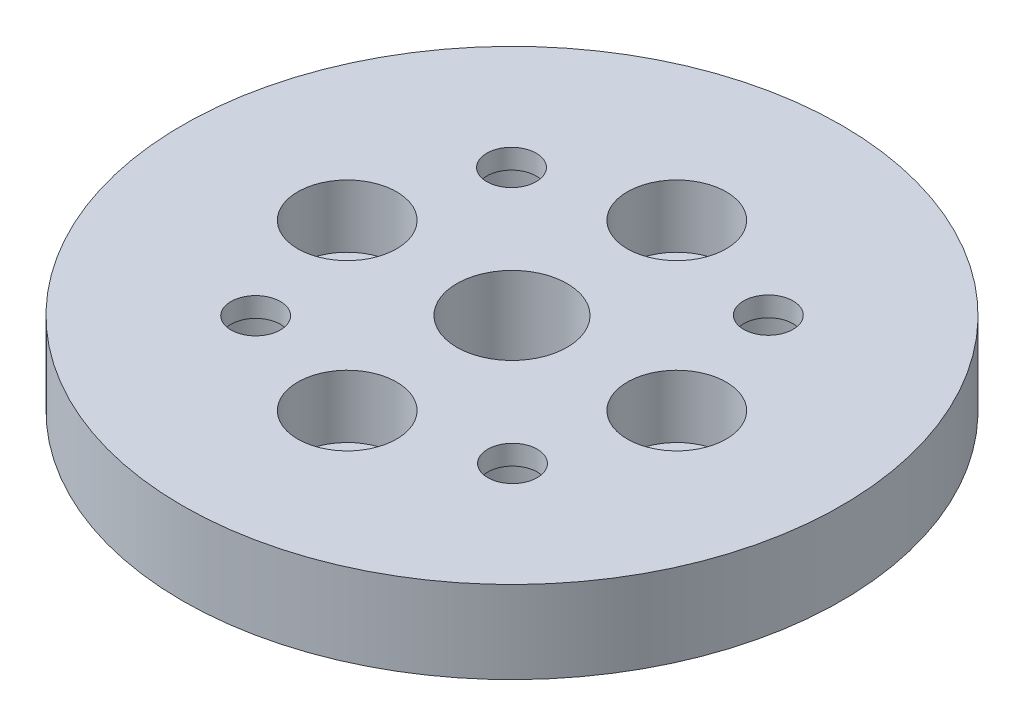
from build123d import *

# Parameters (mm, degrees)
SKETCH2_R           = 20
BOSS_EXTRUDE1_DEPTH = 5
SKETCH3_R           = 3.35
CUT_EXTRUDE1_DEPTH  = 6
SKETCH4_R           = 1.5
CUT_EXTRUDE3_DEPTH  = 6
SKETCH6_R           = 3
CUT_EXTRUDE4_DEPTH  = 3.8
SKETCH7_R           = 1.5
CUT_EXTRUDE5_DEPTH  = 29.722813233
SKETCH8_R           = 3
CUT_EXTRUDE6_DEPTH  = 3.8


with BuildPart() as part:
    # Sketch2 → Boss-Extrude1 (new body)
    with BuildSketch(Plane(origin=(0, 0, 0), x_dir=(1, 0, 0), z_dir=(0, 1, 0))):
        with Locations(Location((0, 0, 0), (0, 0, 270))):
            Circle(SKETCH2_R)
    extrude(amount=BOSS_EXTRUDE1_DEPTH)

    # Sketch3 → Cut-Extrude1 (cut)
    with BuildSketch(Plane(origin=(0, 5, 0), x_dir=(1, 0, 0), z_dir=(0, 1, 0))):
        with Locations(Location((0, 0, 0), (0, 0, 270))):
            Circle(SKETCH3_R)
    extrude(amount=-CUT_EXTRUDE1_DEPTH, mode=Mode.SUBTRACT)

    # Sketch4 → Cut-Extrude3 (cut)
    with BuildSketch(Plane(origin=(0, 5, 0), x_dir=(1, 0, 0), z_dir=(0, 1, 0))):
        with Locations(Location((0, 10, 0), (0, 0, 270))):
            Circle(SKETCH4_R)
        with Locations(Location((10, 0, 0), (0, 0, 270))):
            Circle(SKETCH4_R)
        with Locations(Location((0, -10, 0), (0, 0, 270))):
            Circle(SKETCH4_R)
        with Locations(Location((-10, 0, 0), (0, 0, 270))):
            Circle(SKETCH4_R)
    extrude(amount=-CUT_EXTRUDE3_DEPTH, mode=Mode.SUBTRACT)

    # Sketch6 → Cut-Extrude4 (cut)
    with BuildSketch(Plane(origin=(0, 5, 0), x_dir=(1, 0, 0), z_dir=(0, 1, 0))):
        with Locations(Location((0, 10, 0), (0, 0, 270))):
            Circle(SKETCH6_R)
        with Locations(Location((10, 0, 0), (0, 0, 270))):
            Circle(SKETCH6_R)
        with Locations(Location((0, -10, 0), (0, 0, 270))):
            Circle(SKETCH6_R)
        with Locations(Location((-10, 0, 0), (0, 0, 270))):
            Circle(SKETCH6_R)
    extrude(amount=-CUT_EXTRUDE4_DEPTH, mode=Mode.SUBTRACT)

    # Sketch7 → Cut-Extrude5 (cut, through all)
    with BuildSketch(Plane.XZ):
        with Locations(Location((7.793746467, 7.762571482, 0), (0, 0, 270))):
            Circle(SKETCH7_R)
        with Locations(Location((7.762571482, -7.793746467, 0), (0, 0, 270))):
            Circle(SKETCH7_R)
        with Locations(Location((-7.793746467, -7.762571482, 0), (0, 0, 270))):
            Circle(SKETCH7_R)
        with Locations(Location((-7.762571482, 7.793746467, 0), (0, 0, 270))):
            Circle(SKETCH7_R)
    extrude(amount=-CUT_EXTRUDE5_DEPTH, mode=Mode.SUBTRACT)

    # Sketch8 → Cut-Extrude6 (cut)
    with BuildSketch(Plane(origin=(0, 0, 0), x_dir=(-1, 0, 0), z_dir=(0, -1, 0))):
        with Locations(Location((-7.793746467, -7.762571482, 0), (0, 0, 90))):
            Circle(SKETCH8_R)
        with Locations(Location((-7.762571482, 7.793746467, 0), (0, 0, 90))):
            Circle(SKETCH8_R)
        with Locations(Location((7.793746467, 7.762571482, 0), (0, 0, 90))):
            Circle(SKETCH8_R)
        with Locations(Location((7.762571482, -7.793746467, 0), (0, 0, 90))):
            Circle(SKETCH8_R)
    extrude(amount=-CUT_EXTRUDE6_DEPTH, mode=Mode.SUBTRACT)


solid = part.part
